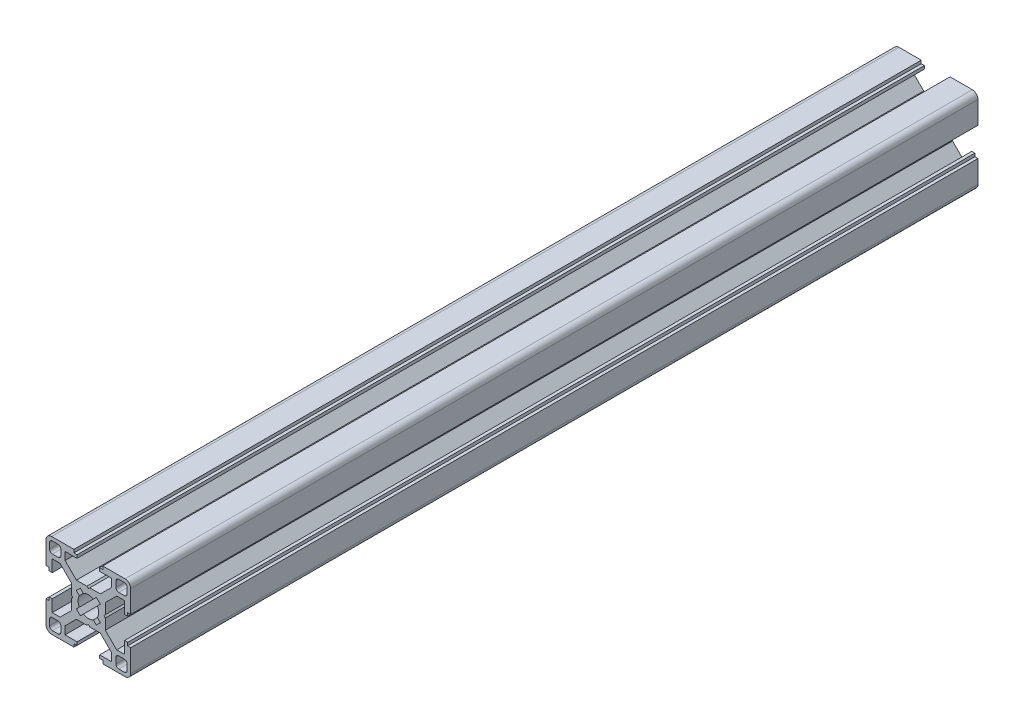
from build123d import *

# Parameters (mm, degrees)
SKETCH1_R                = 3.65
SKETCH1_W                = 4
SKETCH1_H                = 4
BOSS_EXTRUDE1_DEPTH      = 300
FILLET1_R                = 1
CIRPATTERN1_COUNT        = 4
FILLET1_OF_CIRPATTERN1_R = 1
CUT_EXTRUDE1_DEPTH       = 301.749064836
CUT_EXTRUDE2_DEPTH       = 301.749064836
CIRPATTERN2_COUNT        = 4


with BuildPart() as part:
    # Sketch1 → Boss-Extrude1 (new body)
    with BuildSketch(Plane.XY):
        with BuildLine():
            Line((5.1, 15), (13, 15))
            ThreePointArc((13, 15), (14.414213562, 14.414213562), (15, 13))
            Line((15, 13), (15, 5.1))
            Line((15, 5.1), (13.9, 5.1))
            Line((13.9, 5.1), (13.9, 4))
            Line((13.9, 4), (12.8, 4))
            Line((12.8, 4), (12.8, 8.25))
            Line((12.8, 8.25), (10.017766953, 8.25))
            Line((10.017766953, 8.25), (6, 4.232233047))
            Line((6, 4.232233047), (6, -6))
            Line((6, -6), (-6, -6))
            Line((-6, -6), (-6, 6))
            Line((-6, 6), (4.232233047, 6))
            Line((4.232233047, 6), (8.25, 10.017766953))
            Line((8.25, 10.017766953), (8.25, 12.8))
            Line((8.25, 12.8), (4, 12.8))
            Line((4, 12.8), (4, 13.9))
            Line((4, 13.9), (5.1, 13.9))
            Line((5.1, 13.9), (5.1, 15))
        make_face()
        Circle(SKETCH1_R, mode=Mode.SUBTRACT)
        with Locations((11.75, 11.75)):
            Rectangle(SKETCH1_W, SKETCH1_H, mode=Mode.SUBTRACT)
    boss_extrude1 = extrude(amount=BOSS_EXTRUDE1_DEPTH)

    # Fillet1
    fillet1_edges = [part.edges().sort_by_distance(p)[0] for p in [
        (9.75, 13.75, 150),
        (9.75, 9.75, 150),
        (13.75, 9.75, 150),
        (13.75, 13.75, 150),
    ]]
    fillet(fillet1_edges, radius=FILLET1_R)

    # CirPattern1: Boss-Extrude1 ×4 about axis
    cirpattern1_axis = Axis((0, 0, 0), (0, 0, 1))
    for i in range(1, CIRPATTERN1_COUNT):
        add(boss_extrude1.rotate(cirpattern1_axis, i * 360 / CIRPATTERN1_COUNT))

    # Fillet1 of CirPattern1
    fillet1_of_cirpattern1_edges = [part.edges().sort_by_distance(p)[0] for p in [
        (-13.75, 9.75, 150),
        (-9.75, 9.75, 150),
        (-9.75, 13.75, 150),
        (-13.75, 13.75, 150),
        (-9.75, -13.75, 150),
        (-9.75, -9.75, 150),
        (-13.75, -9.75, 150),
        (-13.75, -13.75, 150),
        (13.75, -9.75, 150),
        (9.75, -9.75, 150),
        (9.75, -13.75, 150),
        (13.75, -13.75, 150),
    ]]
    fillet(fillet1_of_cirpattern1_edges, radius=FILLET1_OF_CIRPATTERN1_R)

    # Sketch2 → Cut-Extrude1 (cut, through all)
    with BuildSketch(Plane(origin=(0, 0, 0), x_dir=(-1, 0, 0), z_dir=(0, 0, -1))):
        Polygon((0, 5.5), (-0.5, 6), (0.5, 6), align=None)
    cut_extrude1 = extrude(amount=-CUT_EXTRUDE1_DEPTH, mode=Mode.SUBTRACT)

    # Sketch3 → Cut-Extrude2 (cut, through all)
    with BuildSketch(Plane(origin=(0, 0, 0), x_dir=(-1, 0, 0), z_dir=(0, 0, -1))):
        with BuildLine():
            Line((-1.775079755, 3.189293317), (-2.828427125, 4.242640687))
            Line((-2.828427125, 4.242640687), (-4.242640687, 2.828427125))
            Line((-4.242640687, 2.828427125), (-3.189293317, 1.775079755))
            ThreePointArc((-3.189293317, 1.775079755), (-2.580939751, 2.580939751), (-1.775079755, 3.189293317))
        make_face()
    cut_extrude2 = extrude(amount=-CUT_EXTRUDE2_DEPTH, mode=Mode.SUBTRACT)

    # CirPattern2: Cut-Extrude1, Cut-Extrude2 ×4 about axis
    cirpattern2_axis = Axis((0, 0, 0), (0, 0, 1))
    add([cut_extrude1.rotate(cirpattern2_axis, i * 360 / CIRPATTERN2_COUNT) for i in range(1, CIRPATTERN2_COUNT)], mode=Mode.SUBTRACT)
    add([cut_extrude2.rotate(cirpattern2_axis, i * 360 / CIRPATTERN2_COUNT) for i in range(1, CIRPATTERN2_COUNT)], mode=Mode.SUBTRACT)


solid = part.part
